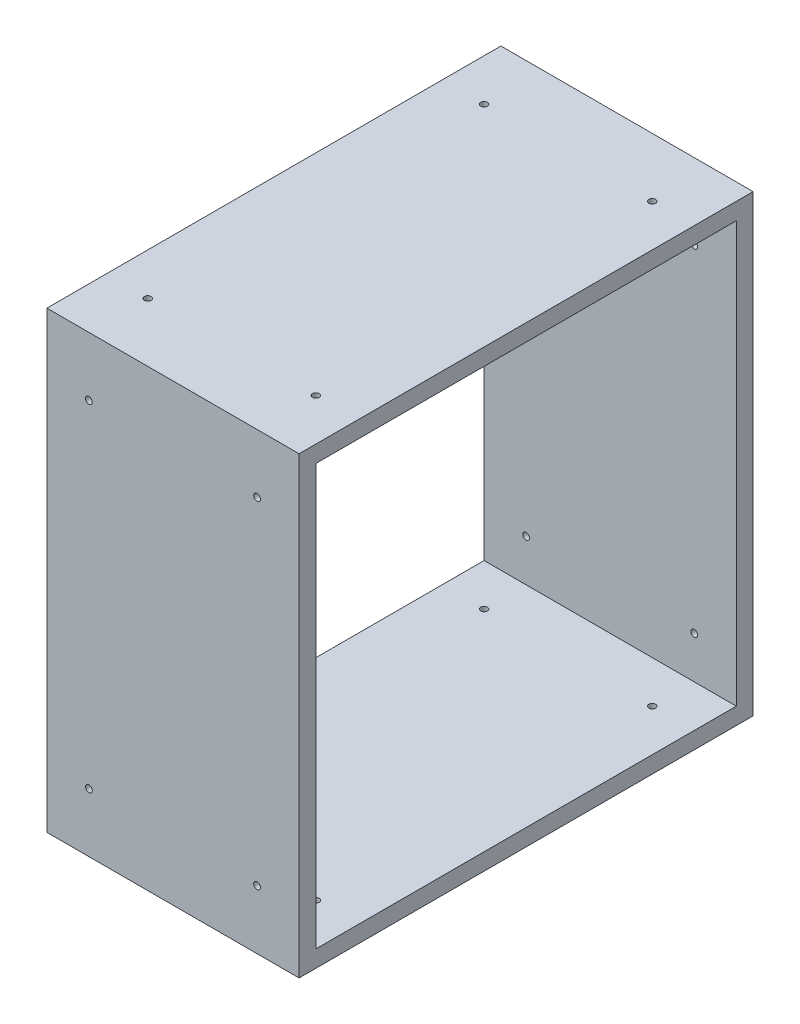
from build123d import *

# Parameters (mm, degrees)
EXTRUDE_1_DEPTH     = 300
SKETCH_2_R          = 4
CUT_EXTRUDE_1_DEPTH = 405.103947024


with BuildPart() as part:
    # 草图1 → 凸台-拉伸1 (new body)
    with BuildSketch(Plane(origin=(0, 0, 0), x_dir=(0, 0, -1), z_dir=(1, 0, 0))):
        Polygon((-250, 0), (-250, 250), (-270, 270), (-270, 0), align=None)
    extrude(amount=EXTRUDE_1_DEPTH)

    # 草图2 → 切除-拉伸1 (cut, through all)
    with BuildSketch(Plane(origin=(0, 0, 250), x_dir=(-1, 0, 0), z_dir=(0, 0, -1))):
        with Locations(Location((-250, 200, 0), (0, 0, 90))):
            Circle(SKETCH_2_R)
        with Locations(Location((-50, 200, 0), (0, 0, 90))):
            Circle(SKETCH_2_R)
    extrude(amount=-CUT_EXTRUDE_1_DEPTH, mode=Mode.SUBTRACT)

    # 镜向1: part across plane


with BuildPart() as part_1:
    add(part.part)
    add(part.part.mirror(Plane(origin=(300, 270, 270), x_dir=(0, 0.7071067811865485, 0.7071067811865466), z_dir=(0, -0.7071067811865466, 0.7071067811865485))))

    # 镜向2: part across plane


with BuildPart() as part_2:
    add(part_1.part)
    add(part_1.part.mirror(Plane(origin=(300, 250, 0), x_dir=(1, 0, 0), z_dir=(0, 0, 1))))

    # 镜向3: part across plane


with BuildPart() as part_3:
    add(part_2.part)
    add(part_2.part.mirror(Plane(origin=(300, 0, -250), x_dir=(0, 0, 1), z_dir=(0, 1, 0))))


solid = part_3.part
